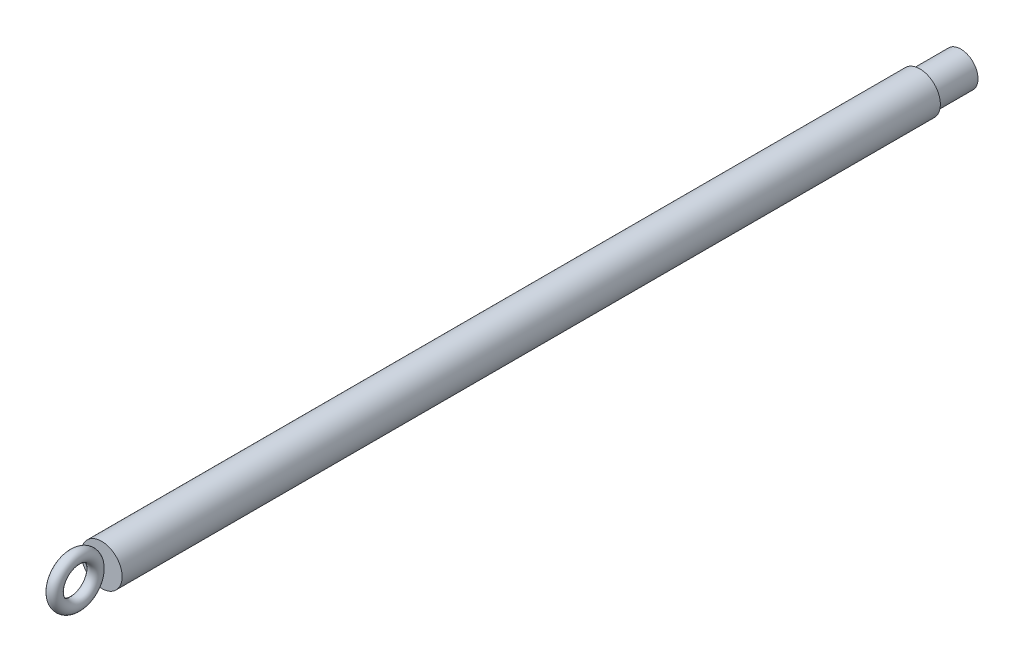
from build123d import *

# Parameters (mm, degrees)
SKETCH1_R           = 2.1
BOSS_EXTRUDE1_DEPTH = 5
SKETCH2_R           = 2.5
BOSS_EXTRUDE2_DEPTH = 100
SKETCH6_R           = 0.75


with BuildPart() as part:
    # Sketch1 → Boss-Extrude1 (new body)
    with BuildSketch(Plane.XY):
        Circle(SKETCH1_R)
    extrude(amount=BOSS_EXTRUDE1_DEPTH)

    # Sketch2 → Boss-Extrude2 (add)
    with BuildSketch(Plane.XY.offset(5)):
        with Locations(Location((0, 0, 0), (0, 0, 180))):
            Circle(SKETCH2_R)
    extrude(amount=BOSS_EXTRUDE2_DEPTH)


with BuildPart() as body_2:
    # Sweep1: sweep along a path in Sketch3
    with BuildLine(Plane(origin=(0, 0, 0), x_dir=(0, 0, -1), z_dir=(1, 0, 0))) as sweep1_path:
        CenterArc((-108.25, 0), 2.5, 0, 360)
    # Sketch6 → Sweep1 (sweep)
    with BuildSketch(Plane(origin=(0, 0, 0), x_dir=(1, 0, 0), z_dir=(0, 1, 0))):
        with Locations((0, -105.75)):
            Circle(SKETCH6_R)
    sweep(path=sweep1_path.line)


solid = Compound([part.part, body_2.part])
